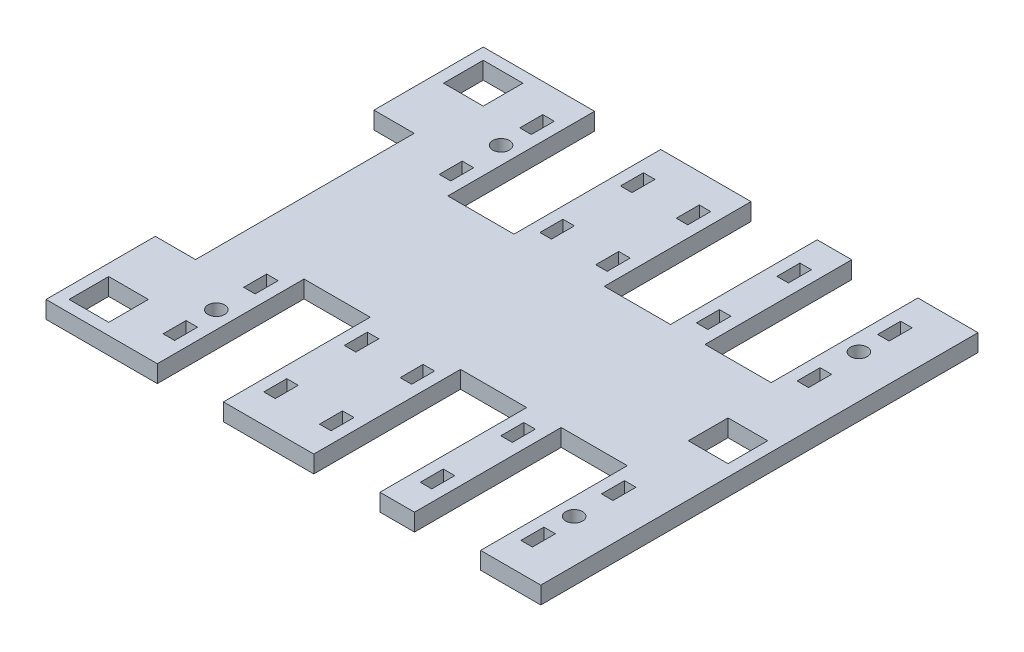
from build123d import *

# Parameters (mm, degrees)
ESQUISSE1_R        = 1.45
ESQUISSE1_W        = 2
ESQUISSE1_H        = 4
ESQUISSE1_W_2      = 6.9
ESQUISSE1_H_2      = 6.9
BOSS_EXTRU_1_DEPTH = 3


with BuildPart() as part:
    # Esquisse1 → Boss.-Extru.1 (new body)
    with BuildSketch(Plane(origin=(0, 0, 0), x_dir=(1, 0, 0), z_dir=(0, 1, 0))):
        Polygon((30.85, 0), (46.55, 0), (46.55, 25.5), (58.05, 25.5), (58.05, 0), (64.05, 0), (64.05, 25.5), (75.55, 25.5), (75.55, 0), (86, 0), (86, 76), (75.55, 76), (75.55, 50.5), (64.05, 50.5), (64.05, 76), (58.05, 76), (58.05, 50.5), (46.55, 50.5), (46.55, 76), (30.85, 76), (30.85, 50.5), (19.35, 50.5), (19.35, 76), (0, 76), (0, 57), (7, 57), (7, 19), (0, 19), (0, 0), (19.35, 0), (19.35, 25.5), (30.85, 25.5), align=None)
        with Locations(Location((16.35, 13.25, 0), (0, 0, 270))):
            Circle(ESQUISSE1_R, mode=Mode.SUBTRACT)
        with Locations(Location((78.55, 13.25, 0), (0, 0, 270))):
            Circle(ESQUISSE1_R, mode=Mode.SUBTRACT)
        with Locations(Location((78.55, 62.75, 0), (0, 0, 90))):
            Circle(ESQUISSE1_R, mode=Mode.SUBTRACT)
        with Locations(Location((16.35, 62.75, 0), (0, 0, 90))):
            Circle(ESQUISSE1_R, mode=Mode.SUBTRACT)
        with Locations((61.05, 7)):
            Rectangle(ESQUISSE1_W, ESQUISSE1_H, mode=Mode.SUBTRACT)
        with Locations((16.35, 7)):
            Rectangle(ESQUISSE1_W, ESQUISSE1_H, mode=Mode.SUBTRACT)
        with Locations((80.55, 38)):
            Rectangle(ESQUISSE1_W_2, ESQUISSE1_H_2, mode=Mode.SUBTRACT)
        with Locations((33.85, 7)):
            Rectangle(ESQUISSE1_W, ESQUISSE1_H, mode=Mode.SUBTRACT)
        with Locations((5.45, 5.45)):
            Rectangle(ESQUISSE1_W_2, ESQUISSE1_H_2, mode=Mode.SUBTRACT)
        with Locations((33.85, 21)):
            Rectangle(ESQUISSE1_W, ESQUISSE1_H, mode=Mode.SUBTRACT)
        with Locations((16.35, 21)):
            Rectangle(ESQUISSE1_W, ESQUISSE1_H, mode=Mode.SUBTRACT)
        with Locations((78.55, 7)):
            Rectangle(ESQUISSE1_W, ESQUISSE1_H, mode=Mode.SUBTRACT)
        with Locations((78.55, 21)):
            Rectangle(ESQUISSE1_W, ESQUISSE1_H, mode=Mode.SUBTRACT)
        with Locations((61.05, 21)):
            Rectangle(ESQUISSE1_W, ESQUISSE1_H, mode=Mode.SUBTRACT)
        with Locations((61.05, 55)):
            Rectangle(ESQUISSE1_W, ESQUISSE1_H, mode=Mode.SUBTRACT)
        with Locations((78.55, 55)):
            Rectangle(ESQUISSE1_W, ESQUISSE1_H, mode=Mode.SUBTRACT)
        with Locations((78.55, 69)):
            Rectangle(ESQUISSE1_W, ESQUISSE1_H, mode=Mode.SUBTRACT)
        with Locations((16.35, 55)):
            Rectangle(ESQUISSE1_W, ESQUISSE1_H, mode=Mode.SUBTRACT)
        with Locations((33.85, 55)):
            Rectangle(ESQUISSE1_W, ESQUISSE1_H, mode=Mode.SUBTRACT)
        with Locations((33.85, 69)):
            Rectangle(ESQUISSE1_W, ESQUISSE1_H, mode=Mode.SUBTRACT)
        with Locations((5.45, 70.55)):
            Rectangle(ESQUISSE1_W_2, ESQUISSE1_H_2, mode=Mode.SUBTRACT)
        with Locations((61.05, 69)):
            Rectangle(ESQUISSE1_W, ESQUISSE1_H, mode=Mode.SUBTRACT)
        with Locations((16.35, 69)):
            Rectangle(ESQUISSE1_W, ESQUISSE1_H, mode=Mode.SUBTRACT)
        with Locations((43.55, 55)):
            Rectangle(ESQUISSE1_W, ESQUISSE1_H, mode=Mode.SUBTRACT)
        with Locations((43.55, 7)):
            Rectangle(ESQUISSE1_W, ESQUISSE1_H, mode=Mode.SUBTRACT)
        with Locations((43.55, 21)):
            Rectangle(ESQUISSE1_W, ESQUISSE1_H, mode=Mode.SUBTRACT)
        with Locations((43.55, 69)):
            Rectangle(ESQUISSE1_W, ESQUISSE1_H, mode=Mode.SUBTRACT)
    extrude(amount=BOSS_EXTRU_1_DEPTH)


solid = part.part
